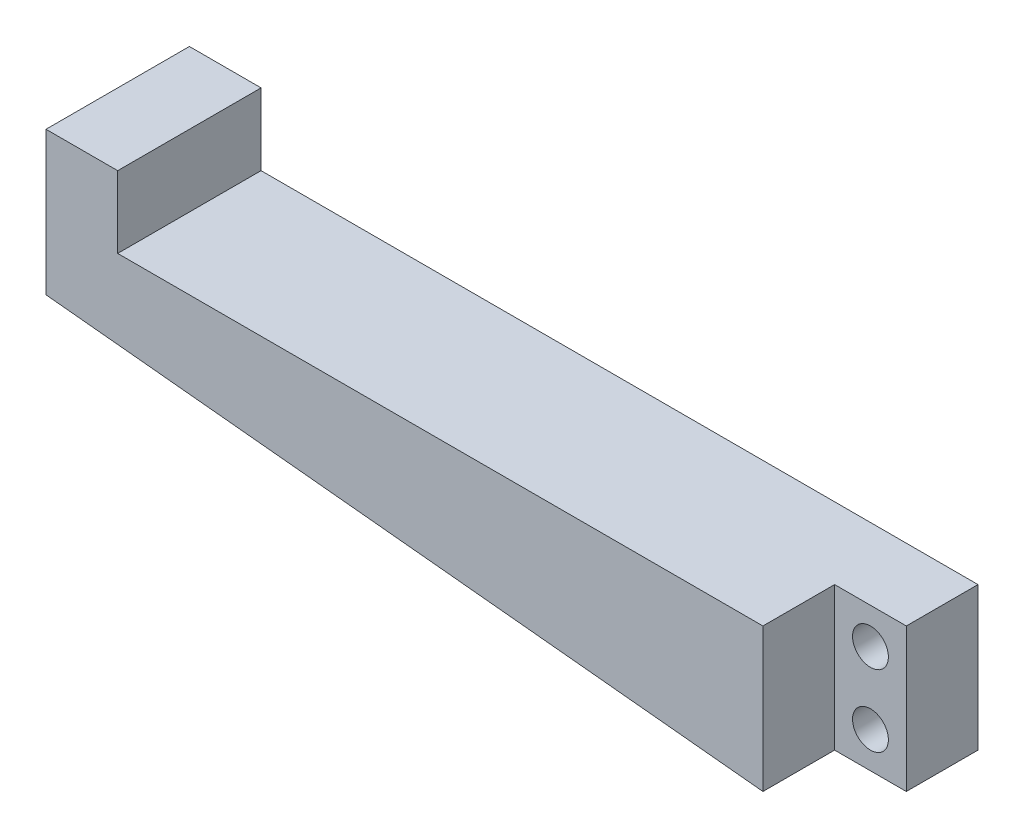
from build123d import *

# Parameters (mm, degrees)
ESQUISSE1_R             = 2.5
BOSS_EXTRU_1_DEPTH      = 20
ESQUISSE2_W             = 10
ESQUISSE2_H             = 20
ENL_V_MAT_EXTRU_1_DEPTH = 10


with BuildPart() as part:
    # Esquisse1 → Boss.-Extru.1 (new body)
    with BuildSketch(Plane.XY):
        Polygon((-105, 0), (-5, -10), (5, -10), (5, 10), (-5, 10), (-95, 10), (-95, 20), (-105, 20), (-105, 10), align=None)
        with Locations((0, 5)):
            Circle(ESQUISSE1_R, mode=Mode.SUBTRACT)
        with Locations((0, -5)):
            Circle(ESQUISSE1_R, mode=Mode.SUBTRACT)
    extrude(amount=BOSS_EXTRU_1_DEPTH)

    # Esquisse2 → Enlèv. mat.-Extru.1 (cut)
    with BuildSketch(Plane.XY.offset(20)):
        Rectangle(ESQUISSE2_W, ESQUISSE2_H)
    extrude(amount=-ENL_V_MAT_EXTRU_1_DEPTH, mode=Mode.SUBTRACT)


solid = part.part
